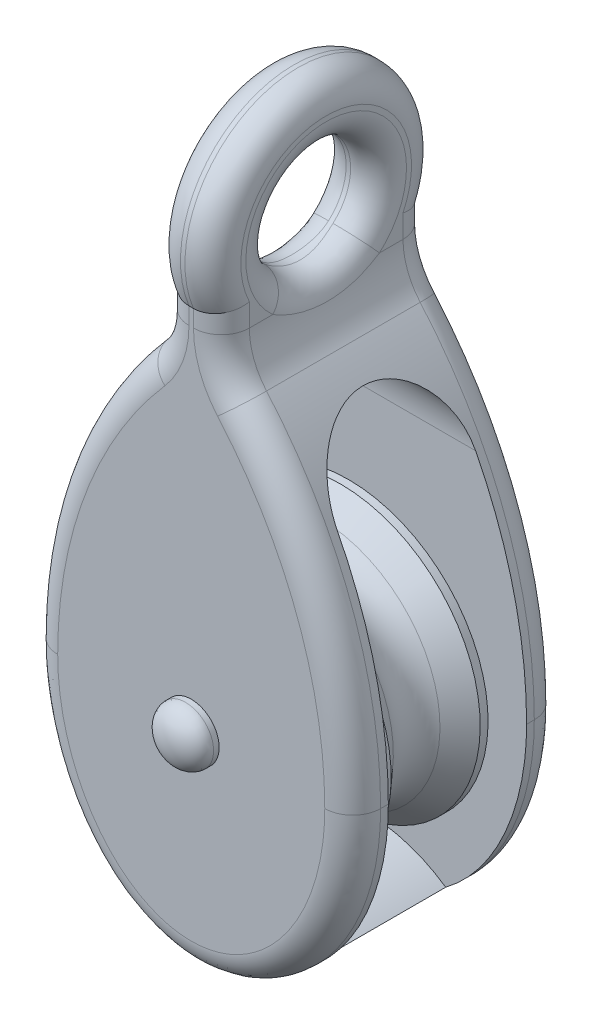
from build123d import *

# Parameters (mm, degrees)
BOSS_EXTRUDE1_DEPTH            = 9.525
CUT_EXTRUDE1_DEPTH             = 76.2
CUT_EXTRUDE1_DEPTH_BACK        = 76.2
SKETCH4_R                      = 4.7625
BOSS_EXTRUDE5_DEPTH            = 2.7432
BOSS_EXTRUDE5_DEPTH_BACK       = 2.7432
SKETCH20_R                     = 10.2997
SKETCH20_R_2                   = 4.7625
CUT_EXTRUDE3_DEPTH             = 52.747793807
CUT_EXTRUDE2_REACH             = 52.89
CUT_EXTRUDE2_DIRECTION_2_REACH = 52.89
FILLET3_R                      = 6.35
FILLET2_R                      = 2.54
SKETCH7_R                      = 2.54
BOSS_EXTRUDE2_DEPTH            = 0.508
DOME1_FACE_RADIUS              = 2.54
DOME1_HEIGHT                   = 1.693333333
MIRROR1_COPY_1_FACE_RADIUS     = 2.54
MIRROR1_COPY_1_HEIGHT          = 1.693333333
BOSS_EXTRUDE3_REACH            = 54.992
SKETCH8_R                      = 1.905


with BuildPart() as part:
    # Sketch1 → Revolve1 (revolve)
    with BuildSketch(Plane(origin=(0, 0, 0), x_dir=(0, 0, -1), z_dir=(1, 0, 0))):
        with BuildLine():
            Line((-4.048125, 12.7), (-2.119357531, 10.970904263))
            ThreePointArc((-2.119357531, 10.970904263), (0, 10.16), (2.119357531, 10.970904263))
            Line((2.119357531, 10.970904263), (4.048125, 12.7))
            Line((4.048125, 12.7), (4.7625, 12.7))
            Line((4.7625, 12.7), (4.7625, 0))
            Line((4.7625, 0), (-4.7625, 0))
            Line((-4.7625, 0), (-4.7625, 12.7))
            Line((-4.7625, 12.7), (-4.048125, 12.7))
        make_face()
    revolve(axis=Axis((0, 0, 4.7625), (0, 0, 1)))


with BuildPart() as body_2:
    # Sketch3 → Boss-Extrude1 (new, symmetric)
    with BuildSketch(Plane.XY):
        with BuildLine():
            Line((-2.7432, 47.625), (2.7432, 47.625))
            Line((2.7432, 47.625), (2.7432, 29.3878))
            ThreePointArc((2.7432, 29.3878), (11.582795369, 15.860001835), (14.6812, 0))
            add(Edge.make_bspline(
                [(-14.6812, 0), (-14.6812, -19.05), (0, -19.05), (14.6812, -19.05), (14.6812, 0)],
                knots=[4.71238898, 4.71238898, 4.71238898, 6.283185307, 6.283185307, 7.853981634, 7.853981634, 7.853981634], degree=2, weights=[1, 0.707106781, 1, 0.707106781, 1]))
            ThreePointArc((-14.6812, 0), (-11.582795369, 15.860001835), (-2.7432, 29.3878))
            Line((-2.7432, 29.3878), (-2.7432, 47.625))
        make_face()
    extrude(amount=BOSS_EXTRUDE1_DEPTH, both=True)

    # Sketch4 → Cut-Extrude1 (cut, two sides: drawn at the far end of the back side and taken through both)
    with BuildSketch(Plane(origin=(0, 0, 0), x_dir=(0, 0, -1), z_dir=(1, 0, 0)).offset(-CUT_EXTRUDE1_DEPTH_BACK)):
        with Locations(Location((0, 37.3253, 0), (0, 0, 180))):
            Circle(SKETCH4_R)
        with BuildLine():
            Line((-6.2865, 19.2151), (-6.2865, -13.335))
            Line((-6.2865, -13.335), (6.2865, -13.335))
            Line((6.2865, -13.335), (6.2865, 19.2151))
            ThreePointArc((6.2865, 19.2151), (0, 25.5016), (-6.2865, 19.2151))
        make_face()
    extrude(amount=CUT_EXTRUDE1_DEPTH + CUT_EXTRUDE1_DEPTH_BACK, mode=Mode.SUBTRACT)

    # Sketch20 → Boss-Extrude5 (add, two sides: drawn at the far end of the back side and taken through both)
    with BuildSketch(Plane(origin=(0, 0, 0), x_dir=(0, 0, -1), z_dir=(1, 0, 0)).offset(-BOSS_EXTRUDE5_DEPTH_BACK)):
        with Locations((0, 37.3253)):
            Circle(SKETCH20_R)
        with Locations(Location((0, 37.3253, 0), (0, 0, 180))):
            Circle(SKETCH20_R_2, mode=Mode.SUBTRACT)
    extrude(amount=BOSS_EXTRUDE5_DEPTH + BOSS_EXTRUDE5_DEPTH_BACK)

    # Sketch21 → Cut-Extrude3 (cut, through all)
    with BuildSketch(Plane.ZY.offset(2.7432)):
        with BuildLine():
            Line((-10.2997, 37.3253), (-12.8397, 37.3253))
            Line((-12.8397, 37.3253), (-12.8397, 50.165))
            Line((-12.8397, 50.165), (12.8397, 50.165))
            Line((12.8397, 50.165), (12.8397, 37.3253))
            Line((12.8397, 37.3253), (10.2997, 37.3253))
            ThreePointArc((10.2997, 37.3253), (0, 47.625), (-10.2997, 37.3253))
        make_face()
    extrude(amount=-CUT_EXTRUDE3_DEPTH, mode=Mode.SUBTRACT)

    # Cut-Extrude2: up to this face of the body (flat: up to its plane)
    cut_extrude2_end = Plane(body_2.part.faces().sort_by_distance((0, 2.692375453, -6.2865))[0])
    # Sketch6 → Cut-Extrude2 (cut, up to the picked face)
    with BuildSketch(Plane.XY, mode=Mode.PRIVATE) as cut_extrude2_sk1:
        with BuildLine():
            Line((-10.484473905, -13.335), (10.484473905, -13.335))
            add(Edge.make_bspline(
                [(7.32426939, -16.51), (9.072467632, -15.20420571), (10.484473905, -13.335)],
                knots=[0.522314822, 0.522314822, 0.522314822, 0.79539883, 0.79539883, 0.79539883], degree=2, weights=[1, 0.990692614, 1]))
            ThreePointArc((7.32426939, -16.51), (0, -14.224), (-7.32426939, -16.51))
            add(Edge.make_bspline(
                [(-10.484473905, -13.335), (-9.072467632, -15.20420571), (-7.32426939, -16.51)],
                knots=[5.487786477, 5.487786477, 5.487786477, 5.760870485, 5.760870485, 5.760870485], degree=2, weights=[1, 0.990692614, 1]))
        make_face()
    cut_extrude2_tool1 = split(extrude(cut_extrude2_sk1.sketch, amount=-CUT_EXTRUDE2_REACH, mode=Mode.PRIVATE), bisect_by=cut_extrude2_end, keep=Keep.BOTH, mode=Mode.PRIVATE)
    add(cut_extrude2_tool1.solids().sort_by(Axis((0, -13.54708, 0), (0, 0, -1)))[0], mode=Mode.SUBTRACT)

    # Cut-Extrude2 direction 2: up to this face of the body (flat: up to its plane)
    cut_extrude2_direction_2_end = Plane(body_2.part.faces().sort_by_distance((0, 2.692375533, 6.2865))[0])
    # Sketch6 → Cut-Extrude2 direction 2 (cut, up to the picked face)
    with BuildSketch(Plane.XY, mode=Mode.PRIVATE) as cut_extrude2_direction_2_sk1:
        with BuildLine():
            Line((-10.484473905, -13.335), (10.484473905, -13.335))
            add(Edge.make_bspline(
                [(7.32426939, -16.51), (9.072467632, -15.20420571), (10.484473905, -13.335)],
                knots=[0.522314822, 0.522314822, 0.522314822, 0.79539883, 0.79539883, 0.79539883], degree=2, weights=[1, 0.990692614, 1]))
            ThreePointArc((7.32426939, -16.51), (0, -14.224), (-7.32426939, -16.51))
            add(Edge.make_bspline(
                [(-10.484473905, -13.335), (-9.072467632, -15.20420571), (-7.32426939, -16.51)],
                knots=[5.487786477, 5.487786477, 5.487786477, 5.760870485, 5.760870485, 5.760870485], degree=2, weights=[1, 0.990692614, 1]))
        make_face()
    cut_extrude2_direction_2_tool1 = split(extrude(cut_extrude2_direction_2_sk1.sketch, amount=CUT_EXTRUDE2_DIRECTION_2_REACH, mode=Mode.PRIVATE), bisect_by=cut_extrude2_direction_2_end, keep=Keep.BOTH, mode=Mode.PRIVATE)
    add(cut_extrude2_direction_2_tool1.solids().sort_by(Axis((0, -13.54708, 0), (0, 0, 1)))[0], mode=Mode.SUBTRACT)

    # Fillet3
    fillet3_edges = [body_2.edges().sort_by_distance(p)[0] for p in [
        (-2.7432, 29.3878, 0),
        (2.7432, 29.3878, 0),
    ]]
    fillet(fillet3_edges, radius=FILLET3_R)

    # Fillet2
    fillet2_edges = [body_2.edges().sort_by_distance(p)[0] for p in [
        (12.002383177, 14.78512787, 9.525),
        (-12.002383177, 14.78512787, 9.525),
        (-12.002383177, 14.78512787, -9.525),
        (2.7432, 32.63470959, 9.525),
        (2.7432, 32.63470959, -9.525),
        (-3.146856412, 29.63518158, -9.525),
        (-3.146856412, 29.63518158, 9.525),
        (3.146856412, 29.63518158, -9.525),
        (3.146856412, 29.63518158, 9.525),
        (2.7432, 37.3253, -4.7625),
        (-2.7432, 37.3253, -4.7625),
        (-2.7432, 32.63470959, -9.525),
        (-2.7432, 32.63470959, 9.525),
        (-2.7432, 47.625, 0),
        (2.7432, 47.625, 0),
        (0, -19.05, 9.525),
        (12.002383177, 14.78512787, -9.525),
        (0, -19.05, -9.525),
    ]]
    fillet(fillet2_edges, radius=FILLET2_R)

    # Sketch7 → Boss-Extrude2 (add)
    with BuildSketch(Plane(origin=(0, 0, -9.525), x_dir=(-1, 0, 0), z_dir=(0, 0, -1))):
        with Locations(Location((0, 0, 0), (0, 0, 180))):
            Circle(SKETCH7_R)
    boss_extrude2 = extrude(amount=BOSS_EXTRUDE2_DEPTH)

    # Dome1: an elliptical dome of height H over a round flat face of radius A is half a spheroid: the quarter ellipse of half axes A and H revolved about the face's axis
    with BuildSketch(Plane((0, 0, -10.033), x_dir=(0, -1, 0), z_dir=(1, 0, 0)), mode=Mode.PRIVATE) as dome1_quarter:
        Ellipse(DOME1_FACE_RADIUS, DOME1_HEIGHT)
        Rectangle(DOME1_FACE_RADIUS, DOME1_HEIGHT, align=(Align.MIN, Align.MIN), mode=Mode.INTERSECT)
    revolve(dome1_quarter.sketch, axis=Axis((0, 0, -10.033), (0, 0, -1)))

    # Mirror1: Boss-Extrude2 across plane
    add(boss_extrude2.mirror(Plane.XY))

    # Mirror1 copy 1: an elliptical dome of height H over a round flat face of radius A is half a spheroid: the quarter ellipse of half axes A and H revolved about the face's axis
    with BuildSketch(Plane((0, 0, 10.033), x_dir=(0, 1, 0), z_dir=(1, 0, 0)), mode=Mode.PRIVATE) as mirror1_copy_1_quarter:
        Ellipse(MIRROR1_COPY_1_FACE_RADIUS, MIRROR1_COPY_1_HEIGHT)
        Rectangle(MIRROR1_COPY_1_FACE_RADIUS, MIRROR1_COPY_1_HEIGHT, align=(Align.MIN, Align.MIN), mode=Mode.INTERSECT)
    revolve(mirror1_copy_1_quarter.sketch, axis=Axis((0, 0, 10.033), (0, 0, 1)))

    # Boss-Extrude3: up to this face of the body (flat: up to its plane)
    boss_extrude3_end = Plane(body_2.part.faces().sort_by_distance((1.4e-08, 2.033448983, 6.2865))[0])
    # Sketch8 → Boss-Extrude3 (add, up to the picked face)
    with BuildSketch(Plane.XY.offset(-6.2865), mode=Mode.PRIVATE) as boss_extrude3_sk1:
        with Locations(Location((0, 0, 0), (0, 0, 90))):
            Circle(SKETCH8_R)
    boss_extrude3_tool1 = split(extrude(boss_extrude3_sk1.sketch, amount=BOSS_EXTRUDE3_REACH, mode=Mode.PRIVATE), bisect_by=boss_extrude3_end, keep=Keep.BOTH, mode=Mode.PRIVATE)

    add(part.part)  # Boss-Extrude3 merges part
    add(boss_extrude3_tool1.solids().sort_by(Axis((0, 0, -6.2865), (0, 0, 1)))[0])


solid = body_2.part
